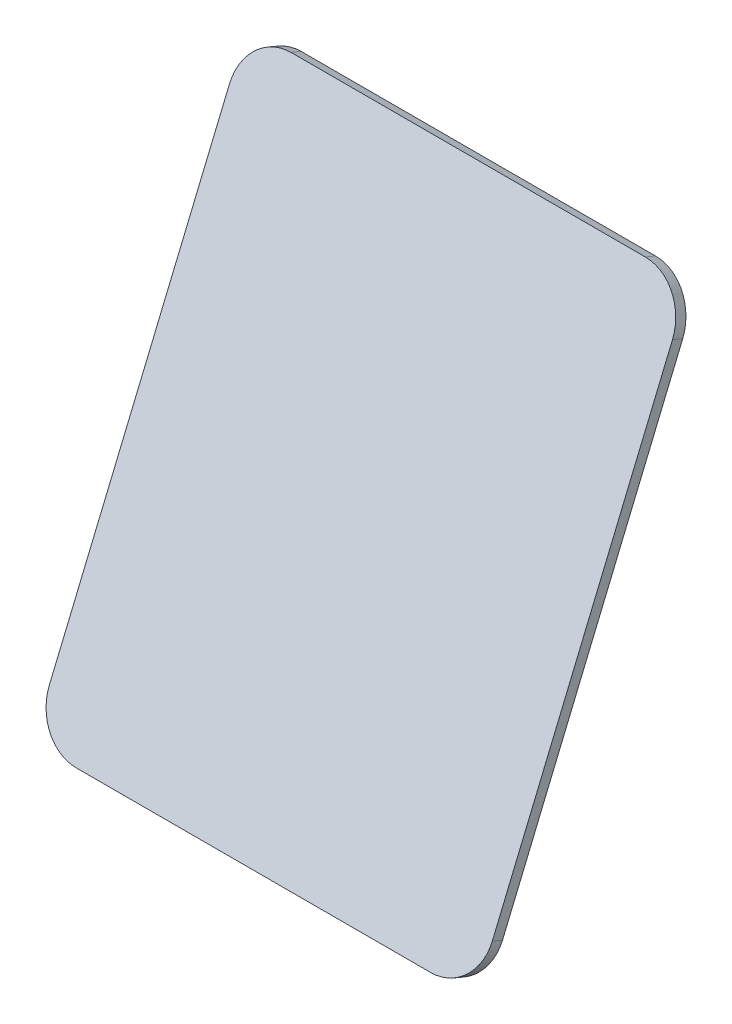
from build123d import *

# Parameters (mm, degrees)
BOSS_EXTRUDE1_START = 0.127
SKETCH1_W           = 127
SKETCH1_H           = 159.272092158
BOSS_EXTRUDE1_DEPTH = 3.175
FILLET1_R           = 12.7


with BuildPart() as part:
    # Sketch1 → Boss-Extrude1 (new body)
    with BuildSketch(Plane(origin=(0, 439.695588184, 1051.066057307), x_dir=(1, 0, 0), z_dir=(0, 0.3859248159835972, 0.9225302360400046)).offset(BOSS_EXTRUDE1_START)):
        with Locations((41.941812484, -201.185691755)):
            Rectangle(SKETCH1_W, SKETCH1_H)
    extrude(amount=BOSS_EXTRUDE1_DEPTH)

    # Fillet1
    fillet1_edges = [part.edges().sort_by_distance(p)[0] for p in [
        (105.441812484, 181.290712191, 1161.023812894),
        (-21.558187516, 181.290712191, 1161.023812894),
        (-21.558187516, 328.224032965, 1099.556760037),
        (105.441812484, 328.224032965, 1099.556760037),
    ]]
    fillet(fillet1_edges, radius=FILLET1_R)


solid = part.part
